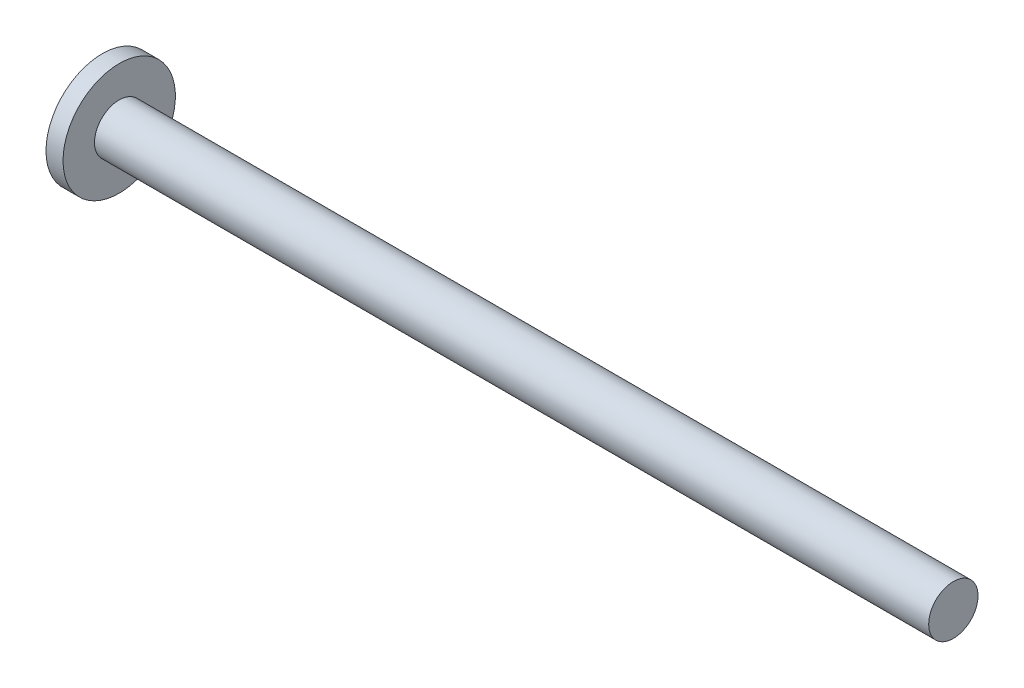
from build123d import *


with BuildPart() as part:
    # Sketch1 → Revolve1 (revolve)
    with BuildSketch(Plane.XY, mode=Mode.PRIVATE) as revolve1_sk:
        Polygon((-80.363757442, 0), (-29.563757442, 0), (-29.563757442, 1.4732), (-79.347757442, 1.4732), (-79.347757442, 3.3528), (-80.363757442, 3.3528), align=None)
    revolve(revolve1_sk.sketch.rotate(Axis((-80.363757442, 0, 0), (1, 0, 0)), 90), axis=Axis((-80.363757442, 0, 0), (1, 0, 0)))


solid = part.part
